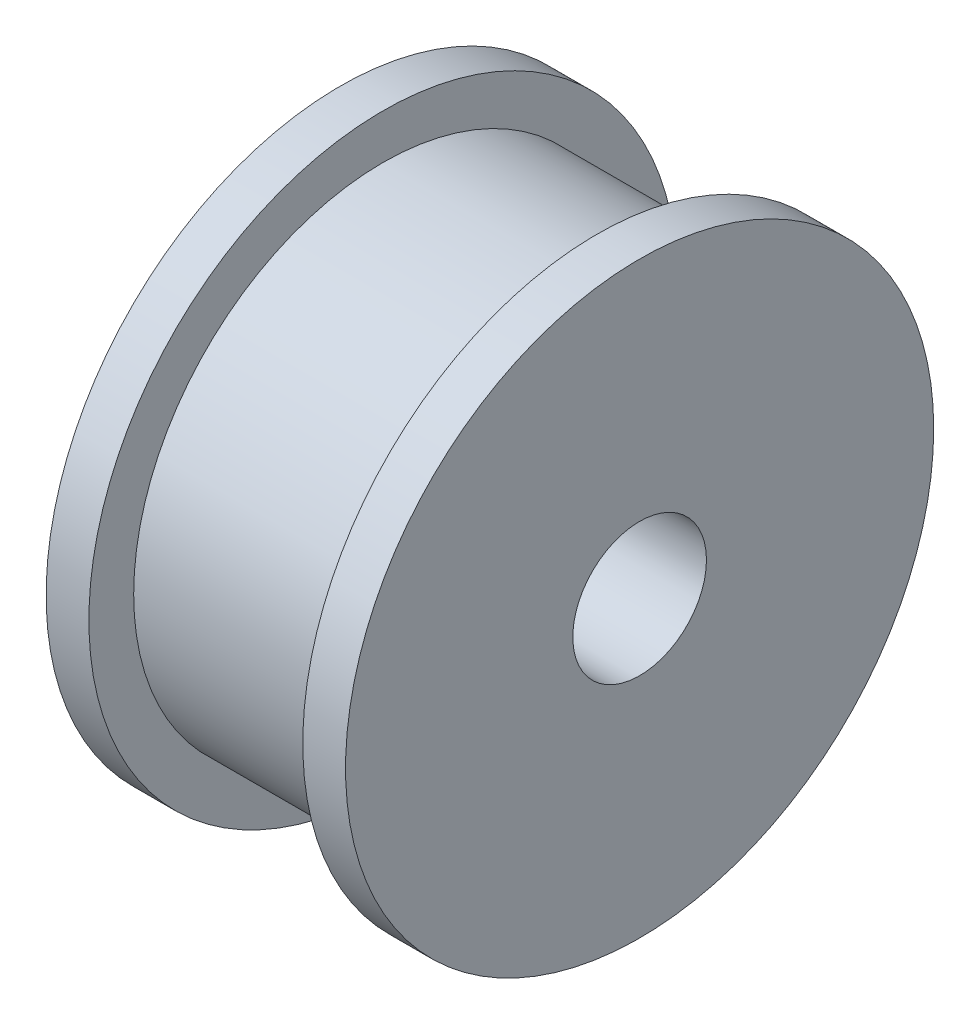
from build123d import *


with BuildPart() as part:
    # Sketch1 → Revolve1 (revolve)
    with BuildSketch(Plane.XY, mode=Mode.PRIVATE) as revolve1_sk:
        Polygon((-5.6, 11), (-4, 11), (-4, 9.325), (4, 9.325), (4, 11), (5.6, 11), (5.6, 2.5), (-5.6, 2.5), align=None)
    revolve(revolve1_sk.sketch.rotate(Axis((0, 0, 0), (-1, 0, 0)), 90), axis=Axis((0, 0, 0), (-1, 0, 0)))


solid = part.part
